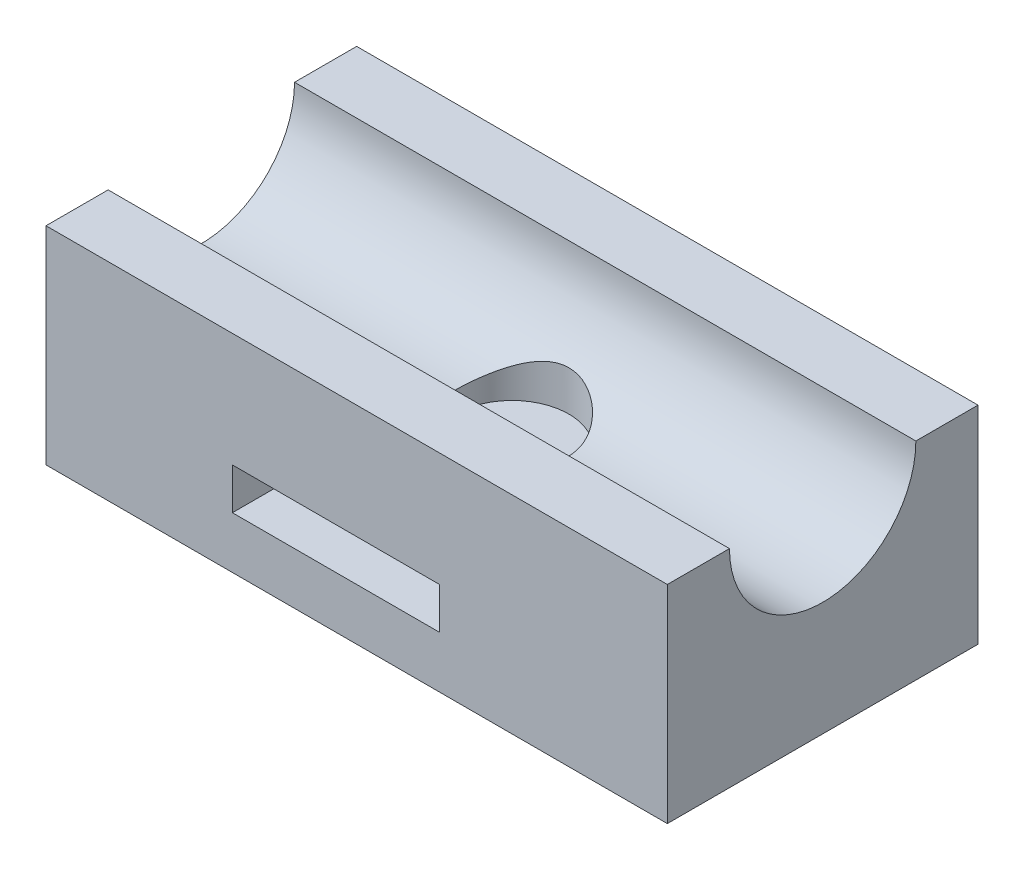
from build123d import *

# Parameters (mm, degrees)
SKETCH1_W           = 76.2
SKETCH1_H           = 38.1
BOSS_EXTRUDE1_DEPTH = 25.4
SKETCH2_R           = 11.43
CUT_EXTRUDE1_DEPTH  = 89.9
SKETCH5_W           = 25.4
SKETCH5_H           = 5.08
CUT_EXTRUDE3_DEPTH  = 89.890839867
SKETCH3_R           = 3.302
CUT_EXTRUDE6_DEPTH  = 89.890839867
CUT_EXTRUDE7_START  = -7.62
SKETCH3_3_R         = 6.985
SKETCH3_3_R_2       = 3.302
CUT_EXTRUDE7_DEPTH  = 10.16


with BuildPart() as part:
    # Sketch1 → Boss-Extrude1 (new body)
    with BuildSketch(Plane(origin=(0, 0, 0), x_dir=(1, 0, 0), z_dir=(0, 1, 0))):
        with Locations((38.089312979, 19.05)):
            Rectangle(SKETCH1_W, SKETCH1_H)
    extrude(amount=BOSS_EXTRUDE1_DEPTH)

    # Sketch2 → Cut-Extrude1 (cut, through all)
    with BuildSketch(Plane.ZY.offset(0.010687021)):
        with Locations((-19.05, 25.4)):
            Circle(SKETCH2_R)
    extrude(amount=-CUT_EXTRUDE1_DEPTH, mode=Mode.SUBTRACT)

    # Sketch5 → Cut-Extrude3 (cut, through all)
    with BuildSketch(Plane(origin=(0, 0, -38.1), x_dir=(-1, 0, 0), z_dir=(0, 0, -1))):
        with Locations((-35.549312979, 8.89)):
            Rectangle(SKETCH5_W, SKETCH5_H)
    extrude(amount=-CUT_EXTRUDE3_DEPTH, mode=Mode.SUBTRACT)

    # Sketch3 → Cut-Extrude6 (cut, through all)
    with BuildSketch(Plane.XZ):
        with Locations((38.089312979, -19.05)):
            Circle(SKETCH3_R)
    extrude(amount=-CUT_EXTRUDE6_DEPTH, mode=Mode.SUBTRACT)

    # Sketch3<3> → Cut-Extrude7 (cut)
    with BuildSketch(Plane.XZ.offset(CUT_EXTRUDE7_START)):
        with Locations((38.089312979, -19.05)):
            Circle(SKETCH3_3_R)
        with Locations((38.089312979, -19.05)):
            Circle(SKETCH3_3_R_2, mode=Mode.SUBTRACT)
    extrude(amount=-CUT_EXTRUDE7_DEPTH, mode=Mode.SUBTRACT)


solid = part.part
